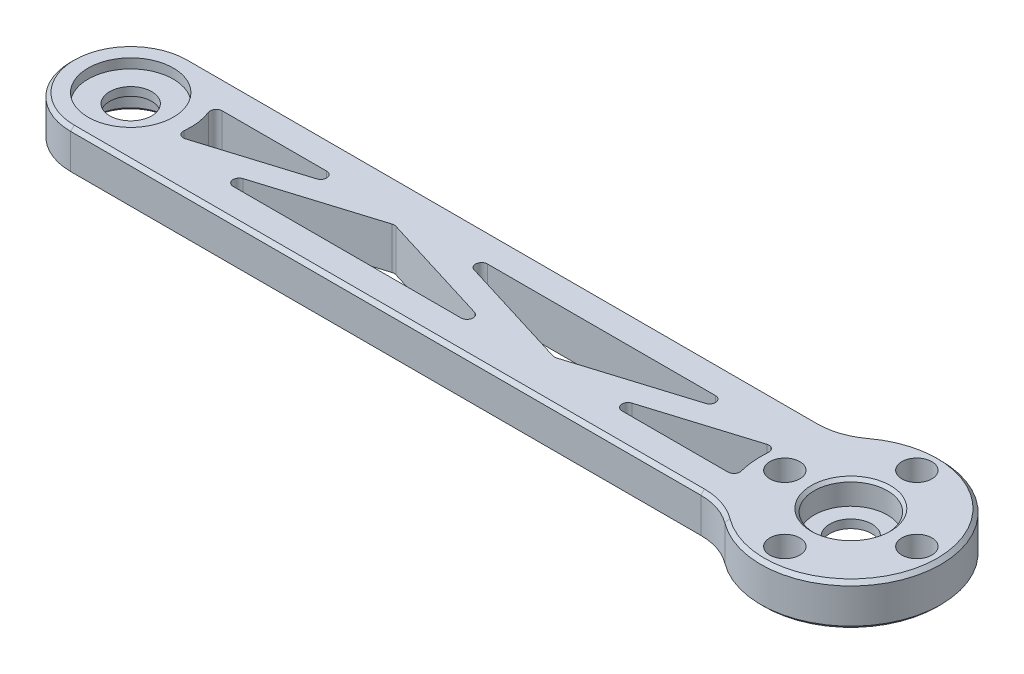
from build123d import *

# Parameters (mm, degrees)
SKETCH_1_R          = 2.5
EXTRUDE_1_DEPTH     = 7
FILLET_1_R          = 1
FILLET_2_R          = 1
FILLET_3_R          = 1
FILLET_4_R          = 1
FILLET_5_R          = 10
SKETCH_2_R          = 7.1
CUT_EXTRUDE_1_DEPTH = 1.6
SKETCH_3_R          = 6.1
CUT_EXTRUDE_2_DEPTH = 4
SKETCH_4_R          = 6.1
CUT_EXTRUDE_4_DEPTH = 4
SKETCH_5_R          = 7.1
CUT_EXTRUDE_5_DEPTH = 1.6
SKETCH_6_R          = 3.5
CUT_EXTRUDE_6_DEPTH = 5
CHAMFER_1_SIZE      = 0.6
CHAMFER_2_SIZE      = 0.5


with BuildPart() as part:
    # 草图1 → 凸台-拉伸1 (new body)
    with BuildSketch(Plane(origin=(0, 0, 0), x_dir=(1, 0, 0), z_dir=(0, 1, 0))):
        with BuildLine():
            Line((-120, 10), (-11.180339887, 10))
            ThreePointArc((-11.180339887, 10), (15, 0), (-11.180339887, -10))
            Line((-11.180339887, -10), (-120, -10))
            ThreePointArc((-120, -10), (-130, 0), (-120, 10))
        make_face()
        with Locations(Location((-11, 0, 0), (0, 0, 270))):
            Circle(SKETCH_1_R, mode=Mode.SUBTRACT)
        with Locations(Location((0, 11, 0), (0, 0, 270))):
            Circle(SKETCH_1_R, mode=Mode.SUBTRACT)
        with Locations(Location((11, 0, 0), (0, 0, 270))):
            Circle(SKETCH_1_R, mode=Mode.SUBTRACT)
        with Locations(Location((0, -11, 0), (0, 0, 270))):
            Circle(SKETCH_1_R, mode=Mode.SUBTRACT)
        Polygon((-104.558275962, -5), (-53.32280907, -5), (-78.940542516, 2.906902245), align=None, mode=Mode.SUBTRACT)
        with BuildLine():
            Line((-111.339745962, 5), (-85.722012516, 5))
            Line((-85.722012516, 5), (-110.343778499, -2.599497322))
            ThreePointArc((-110.343778499, -2.599497322), (-110.084789012, 1.299457992), (-111.339745962, 5))
        make_face(mode=Mode.SUBTRACT)
        Polygon((-72.159072516, 5), (-46.54133907, -2.906902245), (-20.923605624, 5), align=None, mode=Mode.SUBTRACT)
        with BuildLine():
            Line((-39.75986907, -5), (-14.751545054, 2.71880829))
            ThreePointArc((-14.751545054, 2.71880829), (-14.953467696, -1.180594709), (-14.142135624, -5))
            Line((-14.142135624, -5), (-39.75986907, -5))
        make_face(mode=Mode.SUBTRACT)
    extrude(amount=EXTRUDE_1_DEPTH)

    # 圆角1
    fillet_1_edges = [part.edges().sort_by_distance(p)[0] for p in [
        (-85.722012516, 3.5, -5),
        (-111.339745962, 3.5, -5),
        (-110.343778499, 3.5, 2.599497322),
    ]]
    fillet(fillet_1_edges, radius=FILLET_1_R)

    # 圆角2
    fillet_2_edges = [part.edges().sort_by_distance(p)[0] for p in [
        (-104.558275962, 3.5, 5),
        (-53.32280907, 3.5, 5),
        (-78.940542516, 3.5, -2.906902245),
    ]]
    fillet(fillet_2_edges, radius=FILLET_2_R)

    # 圆角3
    fillet_3_edges = [part.edges().sort_by_distance(p)[0] for p in [
        (-46.54133907, 3.5, 2.906902245),
        (-20.923605624, 3.5, -5),
        (-72.159072516, 3.5, -5),
    ]]
    fillet(fillet_3_edges, radius=FILLET_3_R)

    # 圆角4
    fillet_4_edges = [part.edges().sort_by_distance(p)[0] for p in [
        (-39.75986907, 3.5, 5),
        (-14.142135624, 3.5, 5),
        (-14.751545054, 3.5, -2.71880829),
    ]]
    fillet(fillet_4_edges, radius=FILLET_4_R)

    # 圆角5
    fillet_5_edges = [part.edges().sort_by_distance(p)[0] for p in [
        (-11.180339887, 3.5, -10),
        (-11.180339887, 3.5, 10),
    ]]
    fillet(fillet_5_edges, radius=FILLET_5_R)

    # 草图2 → 切除-拉伸1 (cut)
    with BuildSketch(Plane(origin=(0, 0, 0), x_dir=(-1, 0, 0), z_dir=(0, -1, 0))):
        with Locations(Location((0, 0, 0), (0, 0, 90))):
            Circle(SKETCH_2_R)
    extrude(amount=-CUT_EXTRUDE_1_DEPTH, mode=Mode.SUBTRACT)

    # 草图3 → 切除-拉伸2 (cut)
    with BuildSketch(Plane(origin=(0, 0, 0), x_dir=(-1, 0, 0), z_dir=(0, -1, 0))):
        with Locations(Location((120, 0, 0), (0, 0, 90))):
            Circle(SKETCH_3_R)
    extrude(amount=-CUT_EXTRUDE_2_DEPTH, mode=Mode.SUBTRACT)

    # 草图4 → 切除-拉伸4 (cut)
    with BuildSketch(Plane(origin=(0, 7, 0), x_dir=(1, 0, 0), z_dir=(0, 1, 0))):
        with Locations(Location((0, 0, 0), (0, 0, 270))):
            Circle(SKETCH_4_R)
    extrude(amount=-CUT_EXTRUDE_4_DEPTH, mode=Mode.SUBTRACT)

    # 草图5 → 切除-拉伸5 (cut)
    with BuildSketch(Plane(origin=(0, 7, 0), x_dir=(1, 0, 0), z_dir=(0, 1, 0))):
        with Locations(Location((-120, 0, 0), (0, 0, 270))):
            Circle(SKETCH_5_R)
    extrude(amount=-CUT_EXTRUDE_5_DEPTH, mode=Mode.SUBTRACT)

    # 草图6 → 切除-拉伸6 (cut, symmetric)
    with BuildSketch(Plane(origin=(0, 3, 0), x_dir=(1, 0, 0), z_dir=(0, 1, 0))):
        with Locations(Location((0, 0, 0), (0, 0, 270))):
            Circle(SKETCH_6_R)
        with Locations(Location((-120, 0, 0), (0, 0, 270))):
            Circle(SKETCH_6_R)
    extrude(amount=CUT_EXTRUDE_6_DEPTH, both=True, mode=Mode.SUBTRACT)

    # 倒角1
    chamfer_1_edges = [part.edges().sort_by_distance(p)[0] for p in [
        (15, 0, 0),
        (15, 7, 0),
        (-11.83772234, 0, 10.513167019),
        (-11.83772234, 7, 10.513167019),
        (-11.83772234, 0, -10.513167019),
        (-11.83772234, 7, -10.513167019),
        (-130, 0, 0),
        (-67.5, 0, -10),
        (-67.5, 0, 10),
        (-67.5, 7, 10),
        (-67.5, 7, -10),
        (-130, 7, 0),
    ]]
    chamfer(chamfer_1_edges, length=CHAMFER_1_SIZE)

    # 倒角2
    chamfer_2_edges = [part.edges().sort_by_distance(p)[0] for p in [
        (-120, 0, 6.1),
        (0, 7, -6.1),
    ]]
    chamfer(chamfer_2_edges, length=CHAMFER_2_SIZE)


solid = part.part
